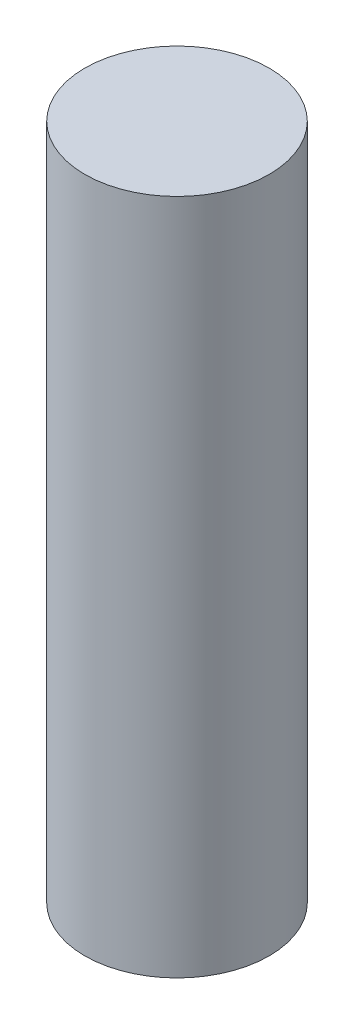
from build123d import *

# Parameters (mm, degrees)
SKETCH3_R           = 9.45
BOSS_EXTRUDE1_DEPTH = 69.41


with BuildPart() as part:
    # Sketch3 → Boss-Extrude1 (new body)
    with BuildSketch(Plane(origin=(0, 0, 0), x_dir=(1, 0, 0), z_dir=(0, 1, 0))):
        with Locations(Location((0, 0, 0), (0, 0, 270))):
            Circle(SKETCH3_R)
    extrude(amount=BOSS_EXTRUDE1_DEPTH)


solid = part.part
